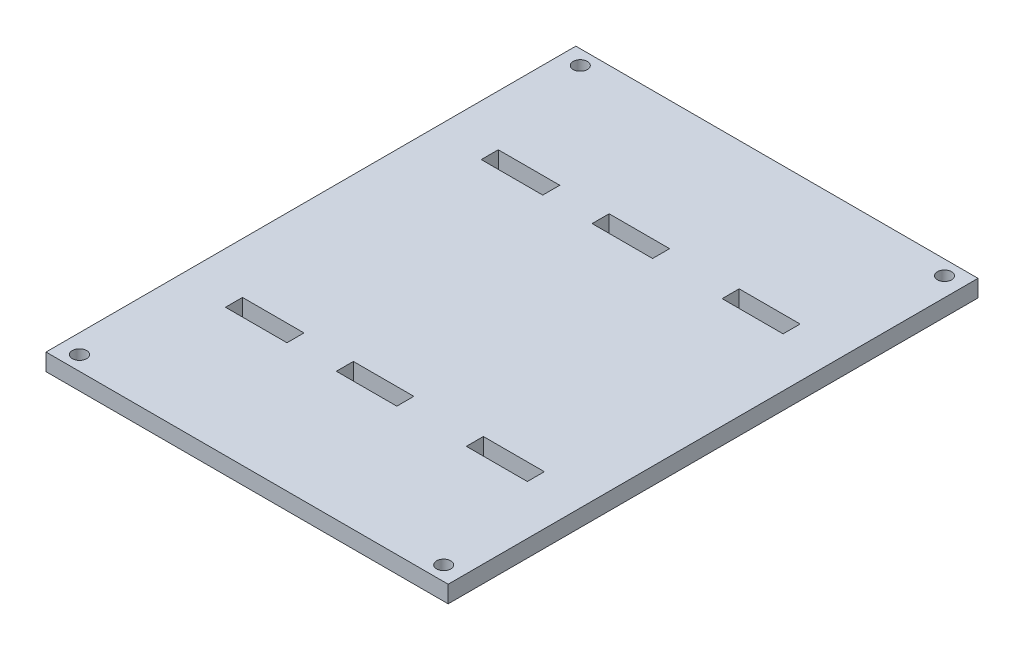
from build123d import *

# Parameters (mm, degrees)
SKETCH1_W           = 125.999999968
SKETCH1_H           = 165.999999978
BOSS_EXTRUDE1_DEPTH = 5.334
SKETCH9_W           = 19.270046927
SKETCH9_H           = 5.334
SKETCH9_W_2         = 18.946166646
SKETCH9_W_3         = 19.104051368
CUT_EXTRUDE1_DEPTH  = 164.220324554
SKETCH10_R          = 2.223521257
SKETCH10_R_2        = 2.222212396
SKETCH10_R_3        = 2.223409271
SKETCH10_R_4        = 2.239695252
CUT_EXTRUDE2_DEPTH  = 164.220324554


with BuildPart() as part:
    # Sketch1 → Boss-Extrude1 (new body)
    with BuildSketch(Plane(origin=(0, 0, 0), x_dir=(1, 0, 0), z_dir=(0, 1, 0))):
        with Locations((38.977787599, 44.330097126)):
            Rectangle(SKETCH1_W, SKETCH1_H)
    extrude(amount=BOSS_EXTRUDE1_DEPTH)

    # Sketch9 → Cut-Extrude1 (cut, through all)
    with BuildSketch(Plane(origin=(0, 5.334, 0), x_dir=(1, 0, 0), z_dir=(0, 1, 0))):
        with Locations((1.575384394, 84.398171813)):
            Rectangle(SKETCH9_W, SKETCH9_H)
        with Locations((36.148083105, 84.398171813)):
            Rectangle(SKETCH9_W_2, SKETCH9_H)
        with Locations((76.961283755, 84.398171813)):
            Rectangle(SKETCH9_W_3, SKETCH9_H)
        with Locations((76.961283755, 4.262022439)):
            Rectangle(SKETCH9_W_3, SKETCH9_H)
        with Locations((36.148083105, 4.262022439)):
            Rectangle(SKETCH9_W_2, SKETCH9_H)
        with Locations((1.575384394, 4.262022439)):
            Rectangle(SKETCH9_W, SKETCH9_H)
    extrude(amount=-CUT_EXTRUDE1_DEPTH, mode=Mode.SUBTRACT)

    # Sketch10 → Cut-Extrude2 (cut, through all)
    with BuildSketch(Plane(origin=(0, 5.334, 0), x_dir=(1, 0, 0), z_dir=(0, 1, 0))):
        with Locations((96.035287599, -34.119902874)):
            Circle(SKETCH10_R)
        with Locations((96.035287599, 122.780097126)):
            Circle(SKETCH10_R_2)
        with Locations((-18.079712401, 122.780097126)):
            Circle(SKETCH10_R_3)
        with Locations((-18.079712401, -34.119902874)):
            Circle(SKETCH10_R_4)
    extrude(amount=-CUT_EXTRUDE2_DEPTH, mode=Mode.SUBTRACT)


solid = part.part
